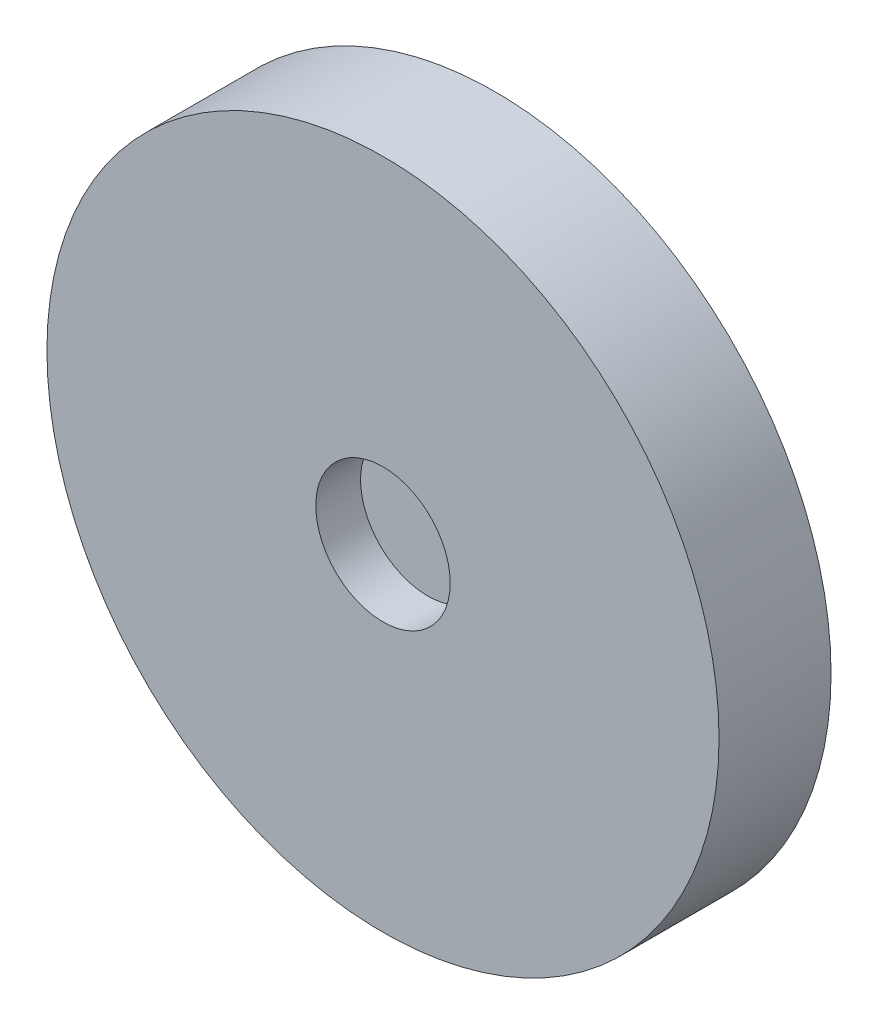
from build123d import *

# Parameters (mm, degrees)
CROQUIS1_R              = 150
SALIENTE_EXTRUIR1_DEPTH = 50
CROQUIS2_R              = 30
CORTAR_EXTRUIR1_DEPTH   = 20


with BuildPart() as part:
    # Croquis1 → Saliente-Extruir1 (new body)
    with BuildSketch(Plane.XY):
        Circle(CROQUIS1_R)
    extrude(amount=SALIENTE_EXTRUIR1_DEPTH)

    # Croquis2 → Cortar-Extruir1 (cut)
    with BuildSketch(Plane.XY.offset(50)):
        Circle(CROQUIS2_R)
    extrude(amount=-CORTAR_EXTRUIR1_DEPTH, mode=Mode.SUBTRACT)


solid = part.part
